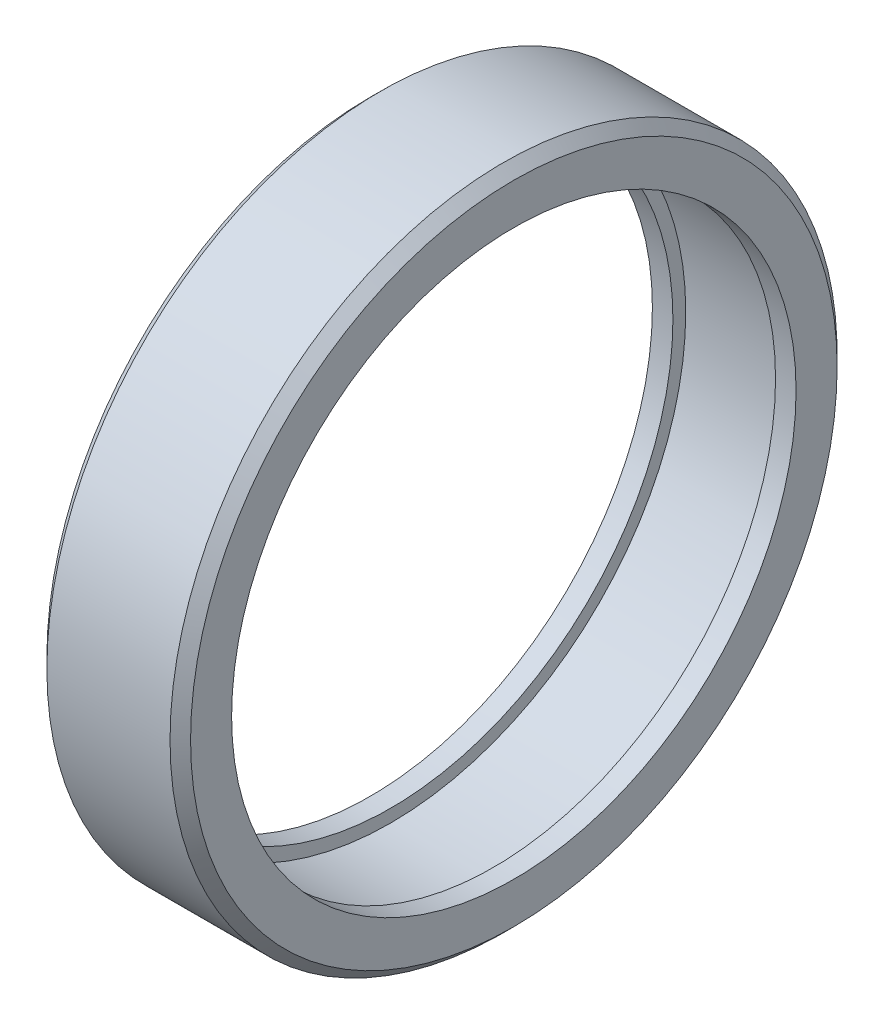
from build123d import *

# Parameters (mm, degrees)
CHAMFER1_SIZE = 2


with BuildPart() as part:
    # Sketch1 → Revolve1 (revolve)
    with BuildSketch(Plane.XY, mode=Mode.PRIVATE) as revolve1_sk:
        Polygon((-10, 55), (-14, 55), (-14, 65), (14, 65), (14, 55), (10, 55), (10, 57.5), (-10, 57.5), align=None)
    revolve(revolve1_sk.sketch.rotate(Axis((0, 0, 0), (1, 0, 0)), 90), axis=Axis((0, 0, 0), (1, 0, 0)))

    # Chamfer1
    chamfer1_edges = [part.edges().sort_by_distance(p)[0] for p in [
        (-14, 0, -65),
        (14, 0, -65),
    ]]
    chamfer(chamfer1_edges, length=CHAMFER1_SIZE)


solid = part.part
